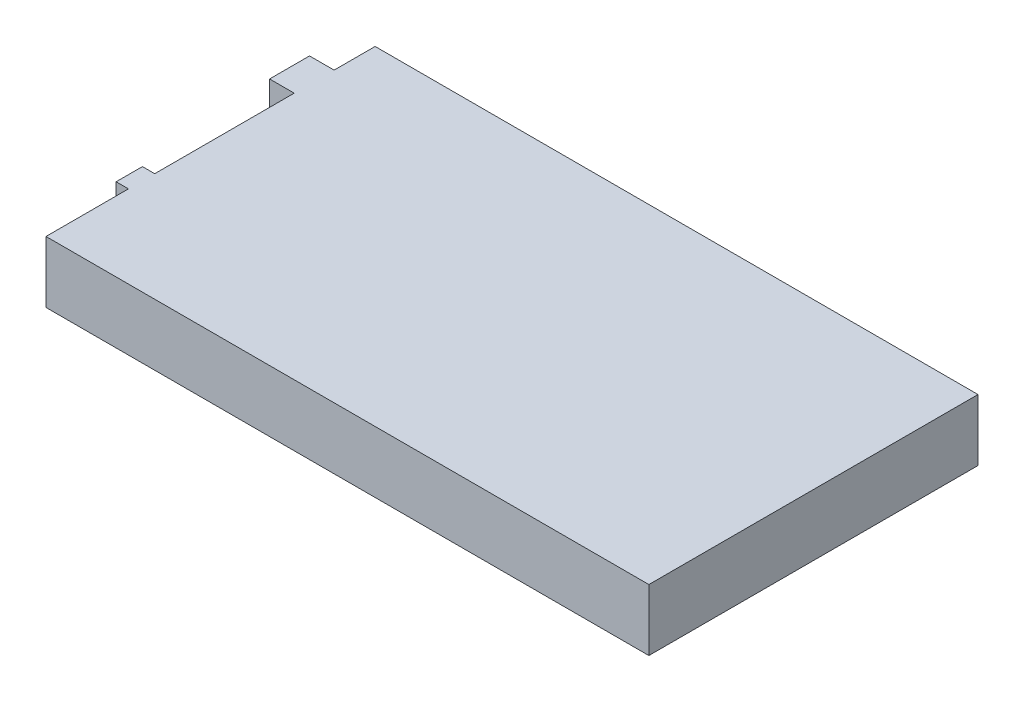
from build123d import *

# Parameters (mm, degrees)
SKETCH_1_W      = 98
SKETCH_1_H      = 53.5
EXTRUDE_1_DEPTH = 10
SKETCH_2_W      = 10.761478591
SKETCH_2_H      = 6.489746631
SKETCH_2_W_2    = 7.311233546
SKETCH_2_H_2    = 4.27173196
EXTRUDE_2_DEPTH = 10


with BuildPart() as part:
    # 草图1 → 凸台-拉伸1 (new body)
    with BuildSketch(Plane(origin=(0, 0, 0), x_dir=(1, 0, 0), z_dir=(0, 1, 0))):
        Rectangle(SKETCH_1_W, SKETCH_1_H)
    extrude(amount=EXTRUDE_1_DEPTH)

    # 草图2 → 凸台-拉伸2 (add)
    with BuildSketch(Plane(origin=(0, 10, 0), x_dir=(1, 0, 0), z_dir=(0, 1, 0))):
        with Locations((-47.619260705, 16.840481764)):
            Rectangle(SKETCH_2_W, SKETCH_2_H)
        with Locations((-47.344383227, -11.213296394)):
            Rectangle(SKETCH_2_W_2, SKETCH_2_H_2)
    extrude(amount=-EXTRUDE_2_DEPTH)


solid = part.part
